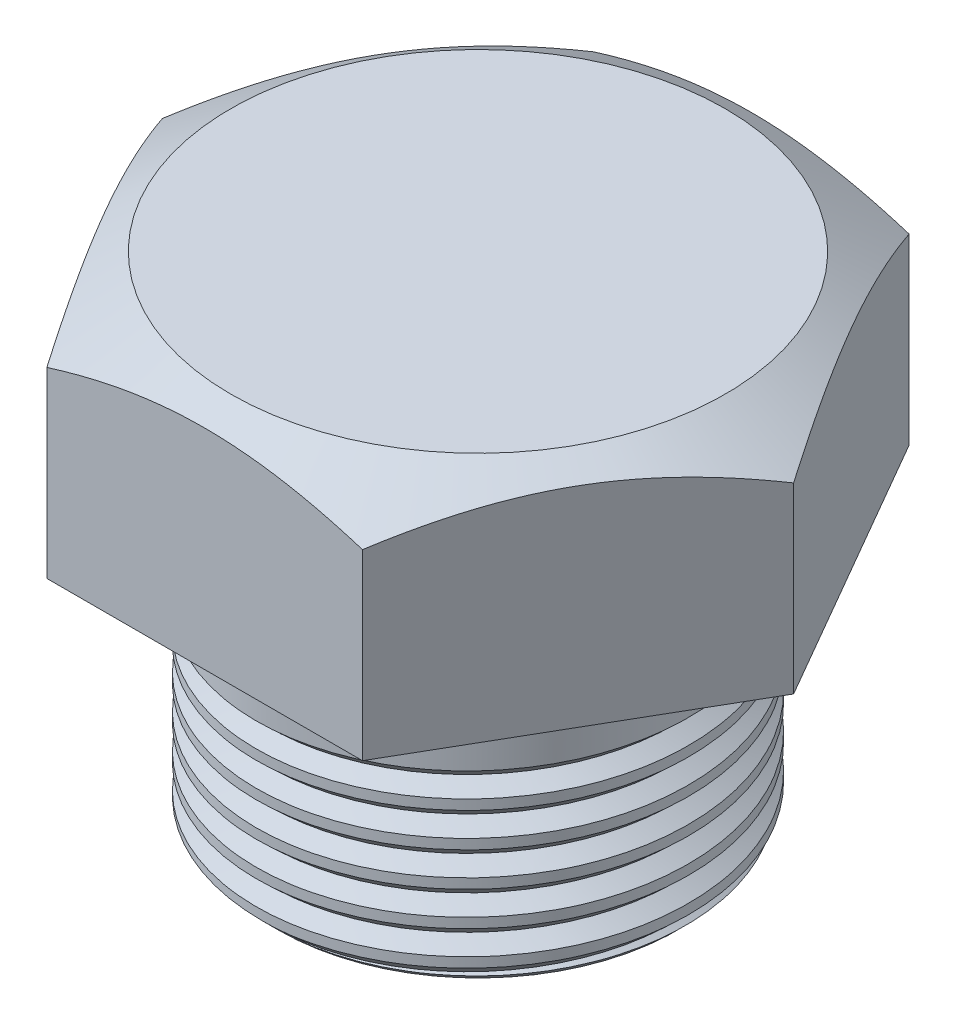
from build123d import *

# Parameters (mm, degrees)
SKETCH1_R              = 12.65
BOSS_EXTRUDE1_DEPTH    = 15.4
BOSS_EXTRUDE2_DEPTH    = 13.2
SKETCH4_R              = 10
CUT_EXTRUDE1_DEPTH     = 24
CHAMFER1_SIZE          = 1
CUT_SWEEP2_PITCH       = 2
CUT_SWEEP2_HEIGHT      = 11
CUT_SWEEP2_RADIUS      = 12.65
CUT_SWEEP2_START_ANGLE = -45


with BuildPart() as part:
    # Sketch1 → Boss-Extrude1 (new body)
    with BuildSketch(Plane(origin=(0, 0, 0), x_dir=(1, 0, 0), z_dir=(0, 1, 0))):
        with Locations(Location((0, 0, 0), (0, 0, 90))):
            Circle(SKETCH1_R)
    extrude(amount=BOSS_EXTRUDE1_DEPTH)

    # Sketch2 → Boss-Extrude2 (add)
    with BuildSketch(Plane(origin=(0, 15.4, 0), x_dir=(1, 0, 0), z_dir=(0, 1, 0))):
        Polygon((-18.475208614, 0), (-9.237604307, -16), (9.237604307, -16), (18.475208614, 0), (9.237604307, 16), (-9.237604307, 16), align=None)
    extrude(amount=BOSS_EXTRUDE2_DEPTH)

    # Cut-Sweep1: sweep along a curve in space
    with BuildLine() as cut_sweep1_path:
        ThreePointArc((0, 15.4, 12.65), (8.944900782, 15.4, 8.944900782), (12.65, 15.4, 0))
        ThreePointArc((12.65, 15.4, 0), (8.944900782, 15.4, -8.944900782), (0, 15.4, -12.65))
        ThreePointArc((0, 15.4, -12.65), (-8.944900782, 15.4, -8.944900782), (-12.65, 15.4, 0))
        ThreePointArc((-12.65, 15.4, 0), (-8.944900782, 15.4, 8.944900782), (0, 15.4, 12.65))
    # Sketch3 → Cut-Sweep1 (sweep, cut)
    with BuildSketch(Plane.XY):
        Polygon((-14.475208614, 28.6), (-18.475208614, 28.6), (-18.475208614, 26.1), align=None)
    sweep(path=cut_sweep1_path.line, mode=Mode.SUBTRACT)

    # Sketch4 → Cut-Extrude1 (cut)
    with BuildSketch(Plane.XZ):
        with Locations(Location((0, 0, 0), (0, 0, 270))):
            Circle(SKETCH4_R)
    extrude(amount=-CUT_EXTRUDE1_DEPTH, mode=Mode.SUBTRACT)

    # Chamfer1
    chamfer1_edges = [part.edges().sort_by_distance(p)[0] for p in [
        (0, 0, 12.65),
    ]]
    chamfer(chamfer1_edges, length=CHAMFER1_SIZE)

    # Cut-Sweep2: sweep along a helix
    with BuildLine() as cut_sweep2_path:
        add(Helix(CUT_SWEEP2_PITCH, CUT_SWEEP2_HEIGHT, CUT_SWEEP2_RADIUS, center=(0, 0, 0), direction=(0, 1, 0), mode=Mode.PRIVATE).rotate(Axis((0, 0, 0), (0, 1, 0)), CUT_SWEEP2_START_ANGLE))
    # Sketch6 → Cut-Sweep2 (sweep, cut)
    with BuildSketch(Plane.XY.offset(8.944900782)):
        Polygon((-7.8, 0), (-9.245, 0.895530569), (-9.245, -0.895530569), align=None)
    sweep(path=cut_sweep2_path.line, is_frenet=True, mode=Mode.SUBTRACT)

    # Sketch7 → Cut-Revolve1 (revolve, cut)
    with BuildSketch(Plane.XY.offset(-8.944900782)):
        Polygon((8.944900782, 11.709545778), (7.8, 11), (8.944900782, 10.290454222), align=None)
    revolve(axis=Axis((8.944900782, 10.290454222, -8.944900782), (-1.6637112960740497e-11, 1.0, 0)), mode=Mode.SUBTRACT)


solid = part.part
